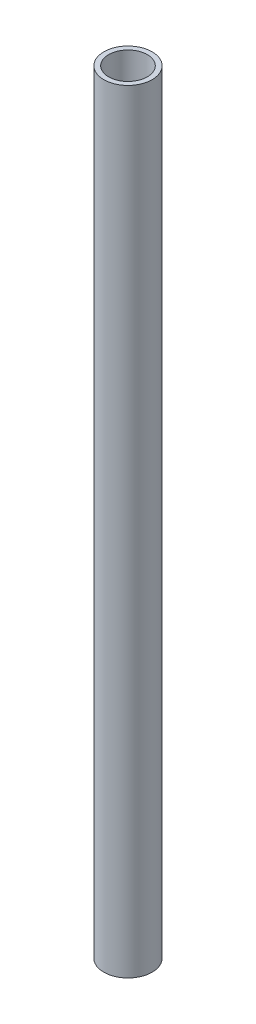
from build123d import *

# Parameters (mm, degrees)
SKETCH1_R           = 2.5
SKETCH1_R_2         = 2
BOSS_EXTRUDE2_DEPTH = 80


with BuildPart() as part:
    # Sketch1 → Boss-Extrude2 (new body)
    with BuildSketch(Plane(origin=(0, 0, 0), x_dir=(1, 0, 0), z_dir=(0, 1, 0))):
        with Locations(Location((0, 0, 0), (0, 0, 270))):
            Circle(SKETCH1_R)
        with Locations(Location((0, 0, 0), (0, 0, 270))):
            Circle(SKETCH1_R_2, mode=Mode.SUBTRACT)
    extrude(amount=BOSS_EXTRUDE2_DEPTH)


solid = part.part
